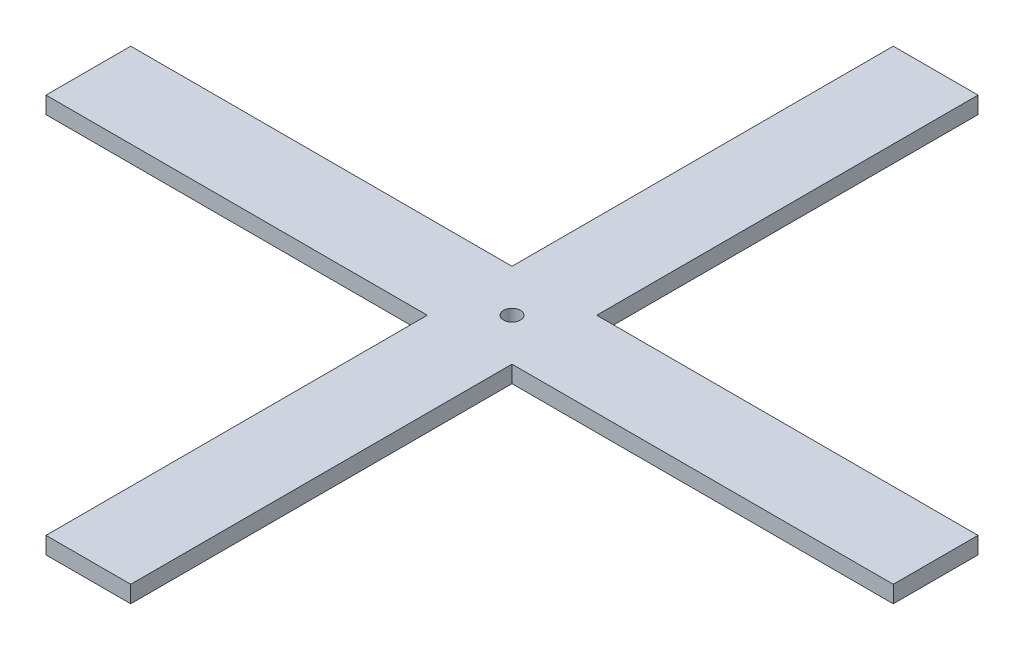
from build123d import *

# Parameters (mm, degrees)
SKETCH1_W               = 500
SKETCH1_H               = 50
BOSS_EXTRUDE1_DEPTH     = 10
SKETCH2_W               = 50
SKETCH2_H               = 500
BOSS_EXTRUDE2_DEPTH     = 10
CUT_EXTRUDE1_DEPTH      = 354.694783677
CUT_EXTRUDE1_DEPTH_BACK = 354.694783677
SKETCH3_R               = 5


with BuildPart() as part:
    # Sketch1 → Boss-Extrude1 (new body)
    with BuildSketch(Plane(origin=(0, 0, 0), x_dir=(1, 0, 0), z_dir=(0, 1, 0))):
        Rectangle(SKETCH1_W, SKETCH1_H)
    extrude(amount=BOSS_EXTRUDE1_DEPTH)

    # Sketch2 → Boss-Extrude2 (add)
    with BuildSketch(Plane(origin=(0, 0, 0), x_dir=(1, 0, 0), z_dir=(0, 1, 0))):
        Rectangle(SKETCH2_W, SKETCH2_H)
    extrude(amount=BOSS_EXTRUDE2_DEPTH)

    # Sketch3 → Cut-Extrude1 (cut, two sides: drawn at the far end of the back side and taken through both)
    with BuildSketch(Plane(origin=(0, 10, 0), x_dir=(1, 0, 0), z_dir=(0, 1, 0)).offset(-CUT_EXTRUDE1_DEPTH_BACK)):
        with Locations(Location((0, 0, 0), (0, 0, 270))):
            Circle(SKETCH3_R)
    extrude(amount=CUT_EXTRUDE1_DEPTH + CUT_EXTRUDE1_DEPTH_BACK, mode=Mode.SUBTRACT)


solid = part.part
